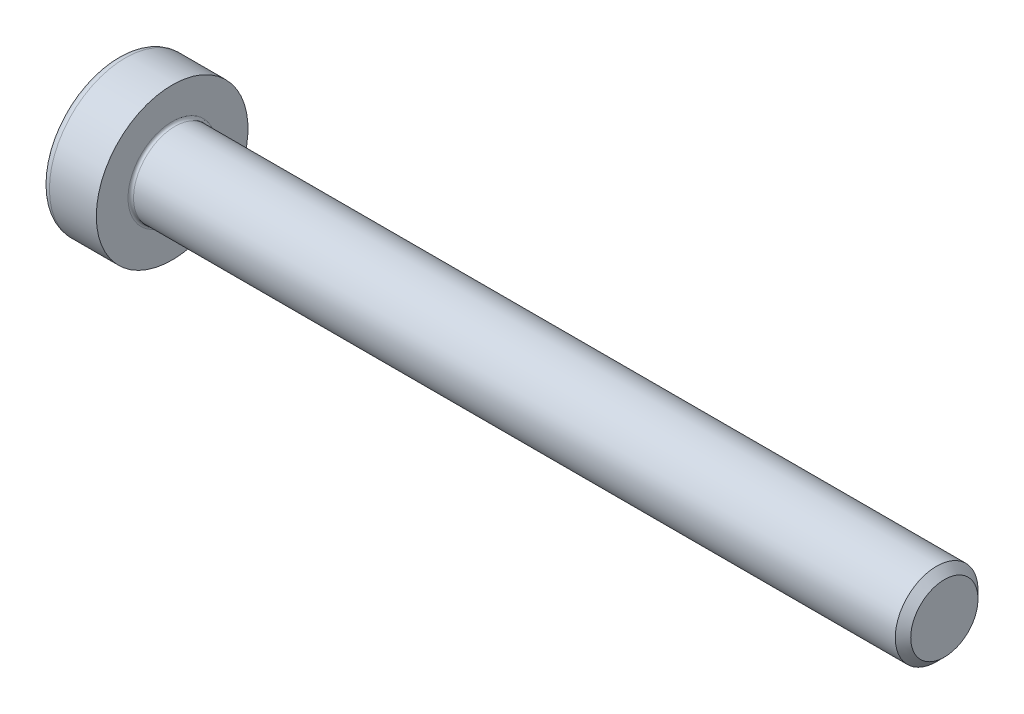
from build123d import *

# Parameters (mm, degrees)
FILLET1_R   = 0.1
FILLET2_R   = 0.3
HEX_2_DEPTH = 1.5


with BuildPart() as part:
    # BodySke → Base-Revolve (revolve)
    with BuildSketch(Plane.XY, mode=Mode.PRIVATE) as base_revolve_sk:
        Polygon((0, 0), (0, 2.75), (2, 2.75), (2, 1.5), (29.7195, 1.5), (30, 1.2195), (30, 0), align=None)
    revolve(base_revolve_sk.sketch.rotate(Axis((-31.75, 0, 0), (1, 0, 0)), 90), axis=Axis((-31.75, 0, 0), (1, 0, 0)))

    # Fillet1
    fillet1_edges = [part.edges().sort_by_distance(p)[0] for p in [
        (2, 0, -1.5),
    ]]
    fillet(fillet1_edges, radius=FILLET1_R)

    # Fillet2
    fillet2_edges = [part.edges().sort_by_distance(p)[0] for p in [
        (0, 0, -2.75),
    ]]
    fillet(fillet2_edges, radius=FILLET2_R)

    # Sketch2 → Hex-PreBroach (revolve, cut)
    with BuildSketch(Plane.XY, mode=Mode.PRIVATE) as hex_prebroach_sk:
        Polygon((0, 1), (1.5, 1), (2.077350269, 0), (0, 0), align=None)
    revolve(hex_prebroach_sk.sketch.rotate(Axis((0, 0, 0), (1, 0, 0)), 90), axis=Axis((0, 0, 0), (1, 0, 0)), mode=Mode.SUBTRACT)

    # Sketch3 → Hex 2 (cut)
    with BuildSketch(Plane(origin=(0, 0, 0), x_dir=(0, 0.500000000000001, 0.866025403784438), z_dir=(-1, 0, 0))):
        Polygon((0.577350269, 1), (-0.577350269, 1), (-1.154700538, 0), (-0.577350269, -1), (0.577350269, -1), (1.154700538, 0), align=None)
    extrude(amount=-HEX_2_DEPTH, mode=Mode.SUBTRACT)


solid = part.part
